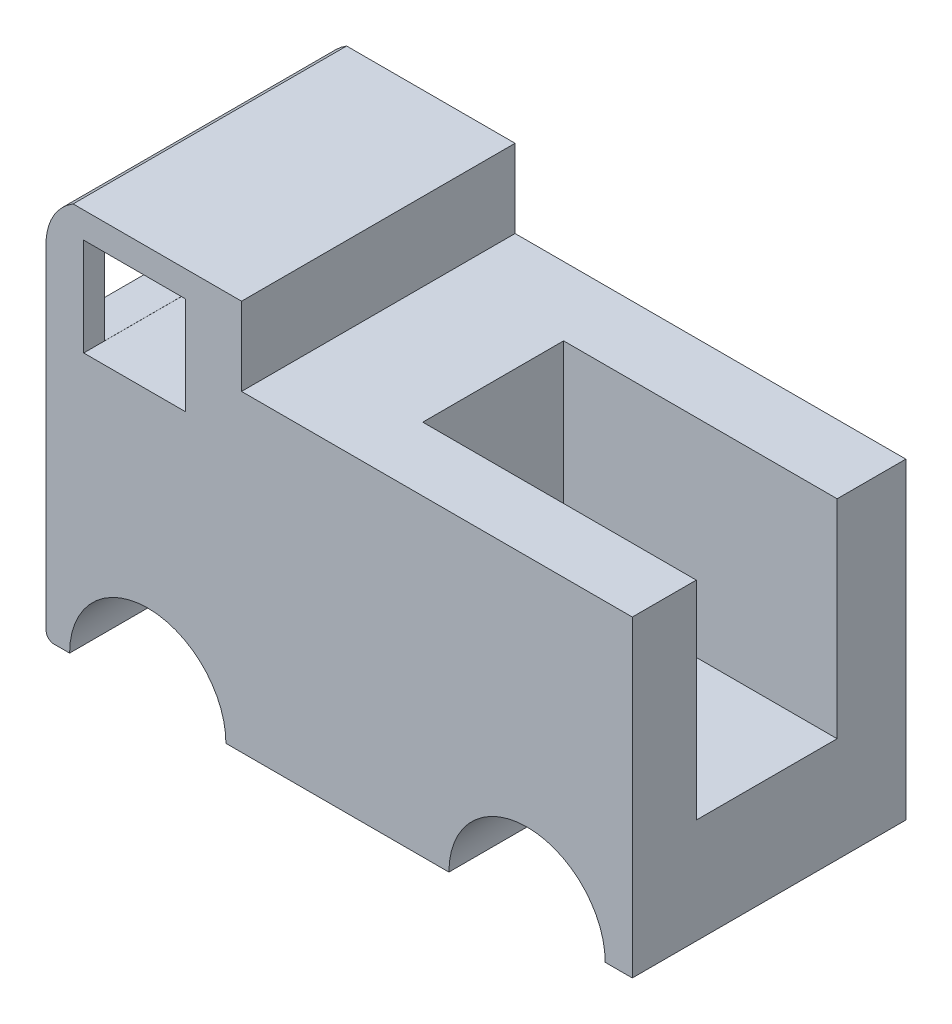
from build123d import *

# Parameters (mm, degrees)
Y_KSEKLIK_EKSTR_ZYON1_DEPTH = 700
IZIM2_W                     = 360.449824165
IZIM2_H                     = 531.81345569
KES_EKSTR_ZYON1_DEPTH       = 700
IZIM3_W                     = 260.927179237
IZIM3_H                     = 250.055213435
KES_EKSTR_ZYON2_DEPTH       = 700
IZIM4_W                     = 592.507682974
IZIM4_H                     = 203.257851284
KES_EKSTR_ZYON3_DEPTH       = 100


with BuildPart() as part:
    # Çizim1 → Yükseklik-Ekstrüzyon1 (new body)
    with BuildSketch(Plane.XY):
        with BuildLine():
            Line((210, -500), (250, -500))
            Line((250, -500), (250, 300))
            Line((250, 300), (250, 500))
            Line((250, 500), (-181.095158938, 500))
            ThreePointArc((-181.095158938, 500), (-229.338190574, 451.785260133), (-250, 386.784176503))
            Line((-250, 386.784176503), (-250, -480))
            ThreePointArc((-250, -480), (-244.142135624, -494.142135624), (-230, -500))
            Line((-230, -500), (-190, -500))
            ThreePointArc((-190, -500), (10, -300), (210, -500))
        make_face()
        with BuildLine():
            ThreePointArc((1180.672940492, -500), (980.672940492, -300), (780.672940492, -500))
            Line((780.672940492, -500), (250, -500))
            Line((250, -500), (250, 300))
            Line((250, 300), (1250, 300))
            Line((1250, 300), (1250, -500))
            Line((1250, -500), (1180.672940492, -500))
        make_face()
    extrude(amount=-Y_KSEKLIK_EKSTR_ZYON1_DEPTH)

    # Çizim2 → Kes-Ekstrüzyon1 (cut)
    with BuildSketch(Plane(origin=(1250, 0, 0), x_dir=(0, 0, -1), z_dir=(1, 0, 0))):
        with Locations((343.970170228, 34.093272155)):
            Rectangle(IZIM2_W, IZIM2_H)
    extrude(amount=-KES_EKSTR_ZYON1_DEPTH, mode=Mode.SUBTRACT)

    # Çizim3 → Kes-Ekstrüzyon2 (cut)
    with BuildSketch(Plane(origin=(0, 0, -700), x_dir=(-1, 0, 0), z_dir=(0, 0, -1))):
        with Locations((23.407496445, 308.297887372)):
            Rectangle(IZIM3_W, IZIM3_H)
    extrude(amount=-KES_EKSTR_ZYON2_DEPTH, mode=Mode.SUBTRACT)

    # Çizim4 → Kes-Ekstrüzyon3 (cut)
    with BuildSketch(Plane.ZY.offset(250)):
        with Locations((-349.282031692, 285.155250861)):
            Rectangle(IZIM4_W, IZIM4_H)
    extrude(amount=-KES_EKSTR_ZYON3_DEPTH, mode=Mode.SUBTRACT)


solid = part.part
